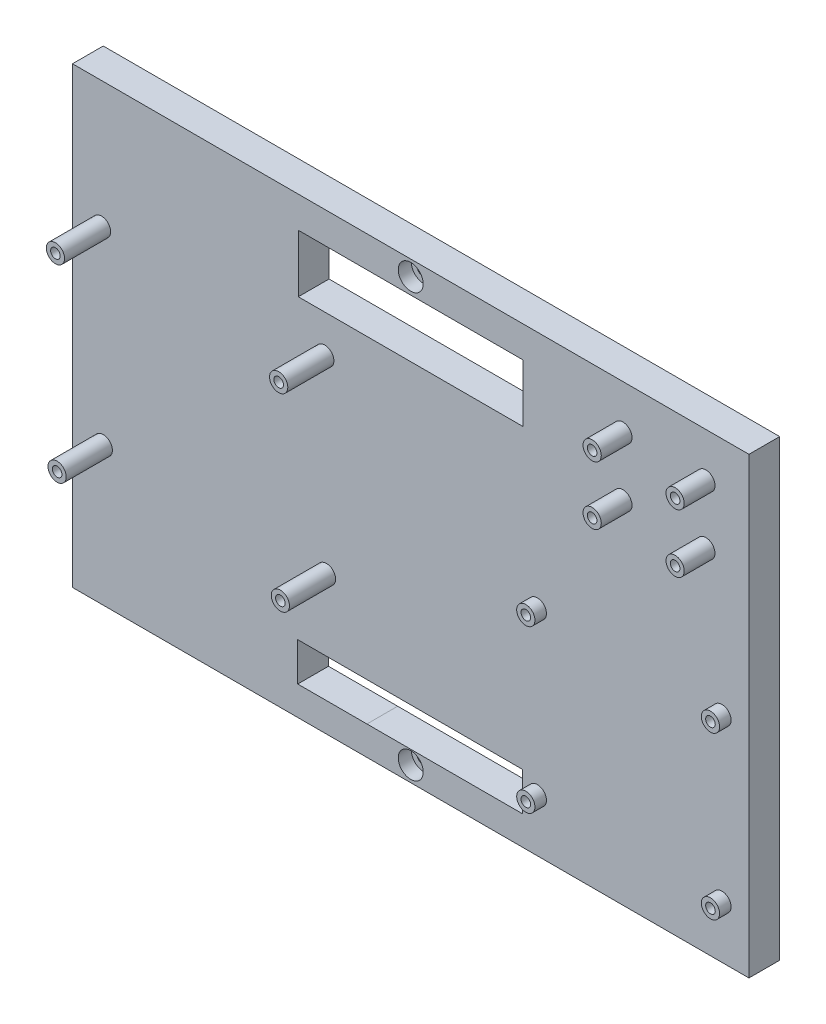
from build123d import *

# Parameters (mm, degrees)
ESQUISSE1_W                                       = 176
ESQUISSE1_H                                       = 118
BOSS_EXTRU_1_DEPTH                                = 8
ESQUISSE5_R                                       = 2.375000003
ESQUISSE5_R_2                                     = 1.250000003
ESQUISSE5_R_3                                     = 2.375
BOSS_EXTRU_2_DEPTH                                = 8
ESQUISSE6_R                                       = 2.375
ESQUISSE6_R_2                                     = 1.25
BOSS_EXTRU_3_DEPTH                                = 12
ESQUISSE8_R                                       = 2.375
ESQUISSE8_R_2                                     = 1.25
BOSS_EXTRU_4_DEPTH                                = 3
ESQUISSE16_W                                      = 18
ESQUISSE16_H                                      = 10
ENL_V_MAT_EXTRU_10_DEPTH                          = 221.800534301
ESQUISSE25_W                                      = 58.5
ESQUISSE25_H                                      = 15
ENL_V_MAT_EXTRU_17_DEPTH                          = 221.220062546
CHAMBRAGE_POUR_VIS_SIX_PANS_CREUX_M31_D           = 3.6
CHAMBRAGE_POUR_VIS_SIX_PANS_CREUX_M31_CBORE_D     = 6.5
CHAMBRAGE_POUR_VIS_SIX_PANS_CREUX_M31_CBORE_DEPTH = 3.4
SKETCH1_W                                         = 22.471601592
SKETCH1_H                                         = 9.999798569
CUT_EXTRUDE2_DEPTH                                = 10


with BuildPart() as part:
    # Esquisse1 → Boss.-Extru.1 (new body)
    with BuildSketch(Plane.XY):
        with Locations((-99.186852624, 56.386126343)):
            Rectangle(ESQUISSE1_W, ESQUISSE1_H)
    extrude(amount=BOSS_EXTRU_1_DEPTH)

    # Esquisse5 → Boss.-Extru.2 (add)
    # profile 1 of 4: a face of its own
    with BuildSketch(Plane.XY.offset(8)):
        with Locations((-22.394011126, 103.894915048)):
            Circle(ESQUISSE5_R)
        with Locations((-22.394011126, 103.894915048)):
            Circle(ESQUISSE5_R_2, mode=Mode.SUBTRACT)
    # profile 2 of 4: a face of its own
    with BuildSketch(Plane.XY.offset(8)):
        with Locations((-43.984011126, 88.654915048)):
            Circle(ESQUISSE5_R_3)
        with Locations((-43.984011126, 88.654915048)):
            Circle(ESQUISSE5_R_2, mode=Mode.SUBTRACT)
    # profile 3 of 4: a face of its own
    with BuildSketch(Plane.XY.offset(8)):
        with Locations((-43.984011126, 103.894915048)):
            Circle(ESQUISSE5_R_3)
        with Locations((-43.984011126, 103.894915048)):
            Circle(ESQUISSE5_R_2, mode=Mode.SUBTRACT)
    # profile 4 of 4: a face of its own
    with BuildSketch(Plane.XY.offset(8)):
        with Locations((-22.394011126, 88.654915048)):
            Circle(ESQUISSE5_R_3)
        with Locations((-22.394011126, 88.654915048)):
            Circle(ESQUISSE5_R_2, mode=Mode.SUBTRACT)
    extrude(amount=BOSS_EXTRU_2_DEPTH)

    # Esquisse6 → Boss.-Extru.3 (add)
    # profile 1 of 4: a face of its own
    with BuildSketch(Plane.XY.offset(8)):
        with Locations((-179.187599449, 33.468198675)):
            Circle(ESQUISSE6_R)
        with Locations((-179.187599449, 33.468198675)):
            Circle(ESQUISSE6_R_2, mode=Mode.SUBTRACT)
    # profile 2 of 4: a face of its own
    with BuildSketch(Plane.XY.offset(8)):
        with Locations((-121.10208697, 33.467532232)):
            Circle(ESQUISSE6_R)
        with Locations((-121.10208697, 33.467532232)):
            Circle(ESQUISSE6_R_2, mode=Mode.SUBTRACT)
    # profile 3 of 4: a face of its own
    with BuildSketch(Plane.XY.offset(8)):
        with Locations((-179.630514203, 82.466196864)):
            Circle(ESQUISSE6_R)
        with Locations((-179.630514203, 82.466196864)):
            Circle(ESQUISSE6_R_2, mode=Mode.SUBTRACT)
    # profile 4 of 4: a face of its own
    with BuildSketch(Plane.XY.offset(8)):
        with Locations((-121.545001725, 82.465530421)):
            Circle(ESQUISSE6_R)
        with Locations((-121.545001725, 82.465530421)):
            Circle(ESQUISSE6_R_2, mode=Mode.SUBTRACT)
    extrude(amount=BOSS_EXTRU_3_DEPTH)

    # Esquisse8 → Boss.-Extru.4 (add)
    # profile 1 of 4: a face of its own
    with BuildSketch(Plane.XY.offset(8)):
        with Locations((-18.201902813, 11.077271698)):
            Circle(ESQUISSE8_R)
        with Locations((-18.201902813, 11.077271698)):
            Circle(ESQUISSE8_R_2, mode=Mode.SUBTRACT)
    # profile 2 of 4: a face of its own
    with BuildSketch(Plane.XY.offset(8)):
        with Locations((-66.241902813, 11.077271698)):
            Circle(ESQUISSE8_R)
        with Locations((-66.241902813, 11.077271698)):
            Circle(ESQUISSE8_R_2, mode=Mode.SUBTRACT)
    # profile 3 of 4: a face of its own
    with BuildSketch(Plane.XY.offset(8)):
        with Locations((-66.241902813, 53.147271698)):
            Circle(ESQUISSE8_R)
        with Locations((-66.241902813, 53.147271698)):
            Circle(ESQUISSE8_R_2, mode=Mode.SUBTRACT)
    # profile 4 of 4: a face of its own
    with BuildSketch(Plane.XY.offset(8)):
        with Locations((-18.201902813, 53.147271698)):
            Circle(ESQUISSE8_R)
        with Locations((-18.201902813, 53.147271698)):
            Circle(ESQUISSE8_R_2, mode=Mode.SUBTRACT)
    extrude(amount=BOSS_EXTRU_4_DEPTH)

    # Esquisse16 → Enlèv. mat.-Extru.10 (cut, through all)
    with BuildSketch(Plane(origin=(0, 0, 0), x_dir=(-1, 0, 0), z_dir=(0, 0, -1))):
        with Locations((79.109390261, 9.929756241)):
            Rectangle(ESQUISSE16_W, ESQUISSE16_H)
        with Locations((119.580991853, 9.92955481)):
            Rectangle(ESQUISSE16_W, ESQUISSE16_H)
    extrude(amount=-ENL_V_MAT_EXTRU_10_DEPTH, mode=Mode.SUBTRACT)

    # Esquisse25 → Enlèv. mat.-Extru.17 (cut, through all)
    with BuildSketch(Plane.XY.offset(8)):
        with Locations((-99.186852624, 99.756126343)):
            Rectangle(ESQUISSE25_W, ESQUISSE25_H)
    extrude(amount=-ENL_V_MAT_EXTRU_17_DEPTH, mode=Mode.SUBTRACT)

    # Chambrage pour vis à six pans creux M31 (through all)
    with Locations(Plane.XY.offset(8)):
        with Locations((-99.186852624, 111.386126343), (-99.186852624, 1.386126343)):
            CounterBoreHole(CHAMBRAGE_POUR_VIS_SIX_PANS_CREUX_M31_D / 2, CHAMBRAGE_POUR_VIS_SIX_PANS_CREUX_M31_CBORE_D / 2, CHAMBRAGE_POUR_VIS_SIX_PANS_CREUX_M31_CBORE_DEPTH)

    # Sketch1 → Cut-Extrude2 (cut)
    with BuildSketch(Plane.XY.offset(8)):
        with Locations((-99.345191057, 9.929655526)):
            Rectangle(SKETCH1_W, SKETCH1_H)
    extrude(amount=-CUT_EXTRUDE2_DEPTH, mode=Mode.SUBTRACT)


solid = part.part
